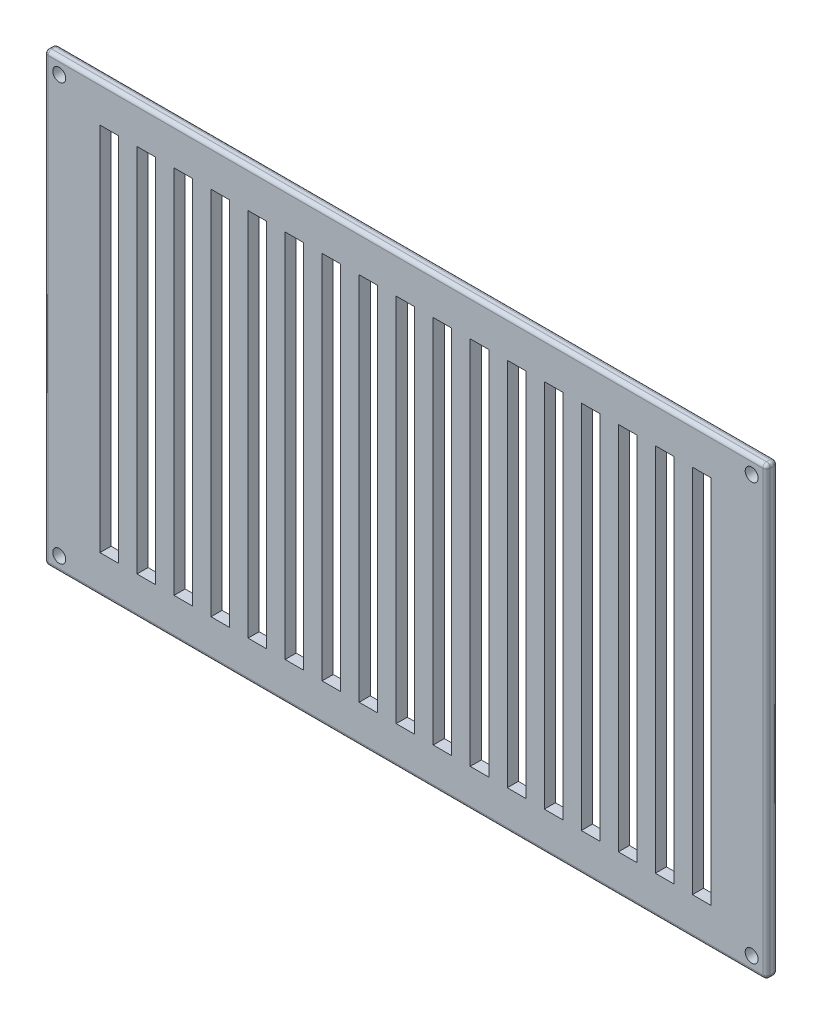
from build123d import *

# Parameters (mm, degrees)
SKETCH1_W           = 195
SKETCH1_H           = 120.54
SKETCH1_R           = 1.75
BOSS_EXTRUDE1_DEPTH = 3
FILLET1_R           = 1
SKETCH3_W           = 5
SKETCH3_H           = 100
CUT_EXTRUDE1_DEPTH  = 230.268165256


with BuildPart() as part:
    # Sketch1 → Boss-Extrude1 (new body)
    with BuildSketch(Plane.XY):
        with Locations((97.5, 60.27)):
            Rectangle(SKETCH1_W, SKETCH1_H)
        with Locations((4, 116.54)):
            Circle(SKETCH1_R, mode=Mode.SUBTRACT)
        with Locations((191, 116.54)):
            Circle(SKETCH1_R, mode=Mode.SUBTRACT)
        with Locations((4, 4)):
            Circle(SKETCH1_R, mode=Mode.SUBTRACT)
        with Locations((191, 4)):
            Circle(SKETCH1_R, mode=Mode.SUBTRACT)
    extrude(amount=BOSS_EXTRUDE1_DEPTH)

    # Fillet1
    fillet1_edges = [part.edges().sort_by_distance(p)[0] for p in [
        (195, 60.27, 3),
        (97.5, 120.54, 3),
        (0, 60.27, 3),
        (97.5, 120.54, 0),
        (195, 60.27, 0),
        (97.5, 0, 0),
        (0, 60.27, 0),
        (0, 120.54, 1.5),
        (195, 120.54, 1.5),
        (195, 0, 1.5),
        (0, 0, 1.5),
        (97.5, 0, 3),
    ]]
    fillet(fillet1_edges, radius=FILLET1_R)

    # Sketch3 → Cut-Extrude1 (cut, through all)
    with BuildSketch(Plane.XY.offset(3)):
        with Locations((27.5, 60.27)):
            Rectangle(SKETCH3_W, SKETCH3_H)
        with Locations((17.5, 60.27)):
            Rectangle(SKETCH3_W, SKETCH3_H)
        with Locations((37.5, 60.27)):
            Rectangle(SKETCH3_W, SKETCH3_H)
        with Locations((47.5, 60.27)):
            Rectangle(SKETCH3_W, SKETCH3_H)
        with Locations((57.5, 60.27)):
            Rectangle(SKETCH3_W, SKETCH3_H)
        with Locations((67.5, 60.27)):
            Rectangle(SKETCH3_W, SKETCH3_H)
        with Locations((77.5, 60.27)):
            Rectangle(SKETCH3_W, SKETCH3_H)
        with Locations((87.5, 60.27)):
            Rectangle(SKETCH3_W, SKETCH3_H)
        with Locations((97.5, 60.27)):
            Rectangle(SKETCH3_W, SKETCH3_H)
        with Locations((107.5, 60.27)):
            Rectangle(SKETCH3_W, SKETCH3_H)
        with Locations((117.5, 60.27)):
            Rectangle(SKETCH3_W, SKETCH3_H)
        with Locations((127.5, 60.27)):
            Rectangle(SKETCH3_W, SKETCH3_H)
        with Locations((137.5, 60.27)):
            Rectangle(SKETCH3_W, SKETCH3_H)
        with Locations((147.5, 60.27)):
            Rectangle(SKETCH3_W, SKETCH3_H)
        with Locations((157.5, 60.27)):
            Rectangle(SKETCH3_W, SKETCH3_H)
        with Locations((167.5, 60.27)):
            Rectangle(SKETCH3_W, SKETCH3_H)
        with Locations((177.5, 60.27)):
            Rectangle(SKETCH3_W, SKETCH3_H)
    extrude(amount=-CUT_EXTRUDE1_DEPTH, mode=Mode.SUBTRACT)


solid = part.part
